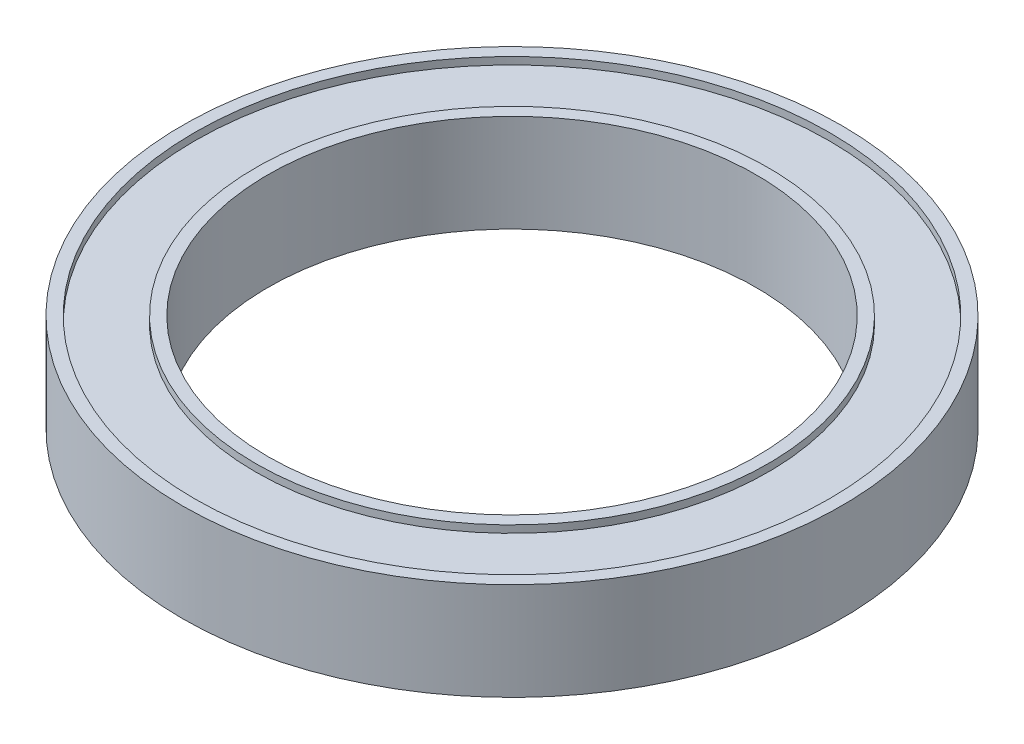
from build123d import *

# Parameters (mm, degrees)
SKETCH_1_R          = 13.5
SKETCH_1_R_2        = 10
EXTRUDE_1_DEPTH     = 4
SKETCH_2_R          = 13
SKETCH_2_R_2        = 10.5
CUT_EXTRUDE_1_DEPTH = 0.3


with BuildPart() as part:
    # 草图1 → 凸台-拉伸1 (new body)
    with BuildSketch(Plane(origin=(0, 0, 0), x_dir=(1, 0, 0), z_dir=(0, 1, 0))):
        with Locations(Location((0, 0, 0), (0, 0, 270))):
            Circle(SKETCH_1_R)
        with Locations(Location((0, 0, 0), (0, 0, 270))):
            Circle(SKETCH_1_R_2, mode=Mode.SUBTRACT)
    extrude(amount=EXTRUDE_1_DEPTH)

    # 草图2 → 切除-拉伸1 (cut)
    with BuildSketch(Plane(origin=(0, 4, 0), x_dir=(1, 0, 0), z_dir=(0, 1, 0))):
        with Locations(Location((0, 0, 0), (0, 0, 270))):
            Circle(SKETCH_2_R)
        with Locations(Location((0, 0, 0), (0, 0, 270))):
            Circle(SKETCH_2_R_2, mode=Mode.SUBTRACT)
    cut_extrude_1 = extrude(amount=-CUT_EXTRUDE_1_DEPTH, mode=Mode.SUBTRACT)

    # 镜向1: 切除-拉伸1 across plane
    add(cut_extrude_1.mirror(Plane.ZX.offset(2)), mode=Mode.SUBTRACT)


solid = part.part
